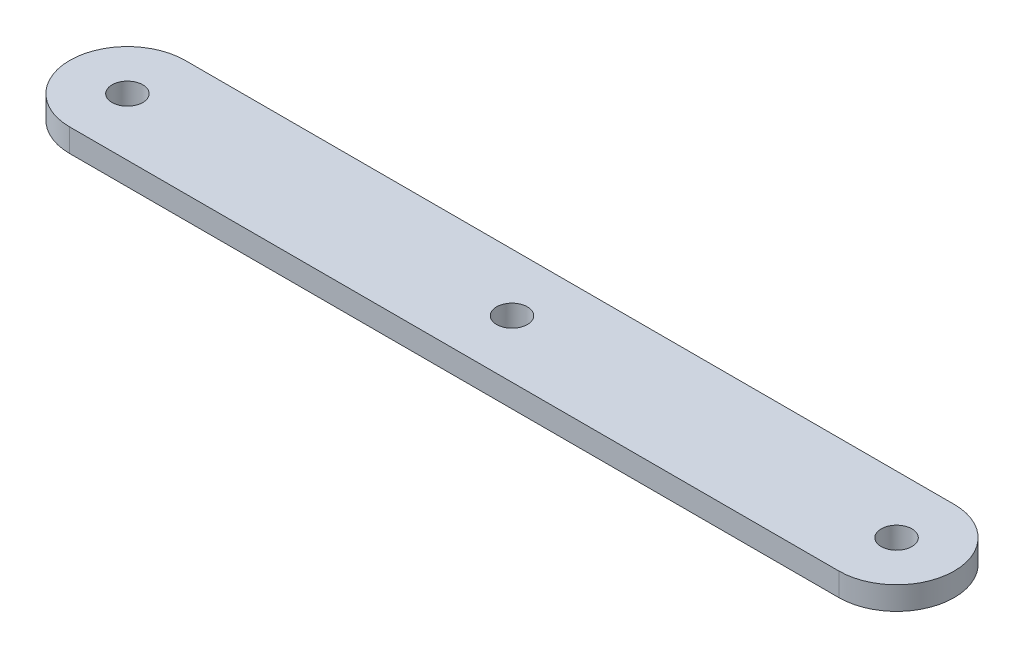
from build123d import *

# Parameters (mm, degrees)
BOSS_EXTRUDE1_DEPTH = 3
SKETCH4_R           = 2
CUT_EXTRUDE1_DEPTH  = 10
SKETCH5_R           = 2
CUT_EXTRUDE2_DEPTH  = 10


with BuildPart() as part:
    # Sketch1 → Boss-Extrude1 (new body)
    with BuildSketch(Plane(origin=(0, 0, 0), x_dir=(1, 0, 0), z_dir=(0, 1, 0))):
        with BuildLine():
            Line((50, -7.5), (-50, -7.5))
            ThreePointArc((-50, -7.5), (-57.5, 0), (-50, 7.5))
            Line((-50, 7.5), (50, 7.5))
            ThreePointArc((50, 7.5), (57.5, 0), (50, -7.5))
        make_face()
    extrude(amount=BOSS_EXTRUDE1_DEPTH)

    # Sketch4 → Cut-Extrude1 (cut)
    with BuildSketch(Plane(origin=(0, 3, 0), x_dir=(1, 0, 0), z_dir=(0, 1, 0))):
        with Locations(Location((-50, 0, 0), (0, 0, 270))):
            Circle(SKETCH4_R)
        with Locations(Location((50, 0, 0), (0, 0, 270))):
            Circle(SKETCH4_R)
    extrude(amount=-CUT_EXTRUDE1_DEPTH, mode=Mode.SUBTRACT)

    # Sketch5 → Cut-Extrude2 (cut)
    with BuildSketch(Plane(origin=(0, 3, 0), x_dir=(1, 0, 0), z_dir=(0, 1, 0))):
        with Locations(Location((0, 0, 0), (0, 0, 270))):
            Circle(SKETCH5_R)
    extrude(amount=-CUT_EXTRUDE2_DEPTH, mode=Mode.SUBTRACT)


solid = part.part
